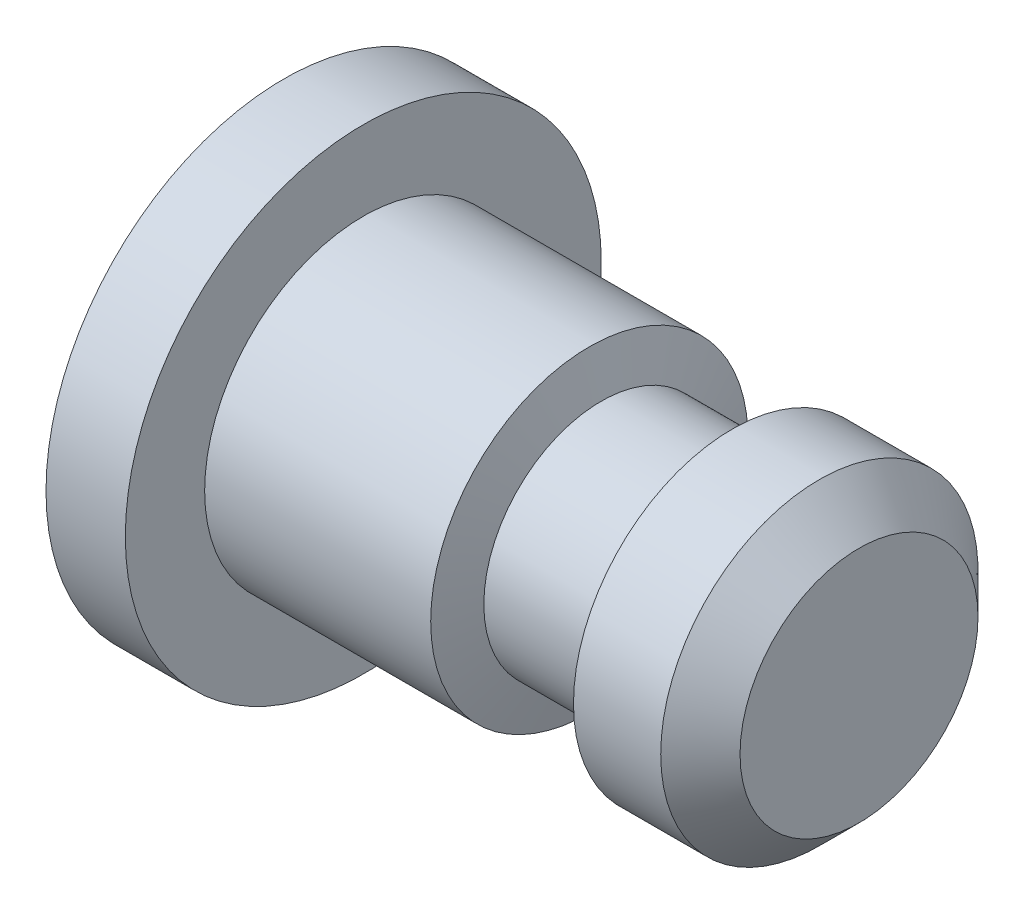
from build123d import *

# Parameters (mm, degrees)
CHAMFER1_SIZE = 1


with BuildPart() as part:
    # Sketch1 → Revolve1 (revolve)
    with BuildSketch(Plane.XY, mode=Mode.PRIVATE) as revolve1_sk:
        Polygon((0, 6), (0, 0), (14.5, 0), (14.5, 4), (11.3, 4), (11, 2.960644881), (8, 2.960644881), (7.7, 4), (2, 4), (2, 6), align=None)
    revolve(revolve1_sk.sketch.rotate(Axis((0, 0, 0), (1, 0, 0)), 90), axis=Axis((0, 0, 0), (1, 0, 0)))

    # Chamfer1
    chamfer1_edges = [part.edges().sort_by_distance(p)[0] for p in [
        (14.5, 0, -4),
    ]]
    chamfer(chamfer1_edges, length=CHAMFER1_SIZE)


solid = part.part
